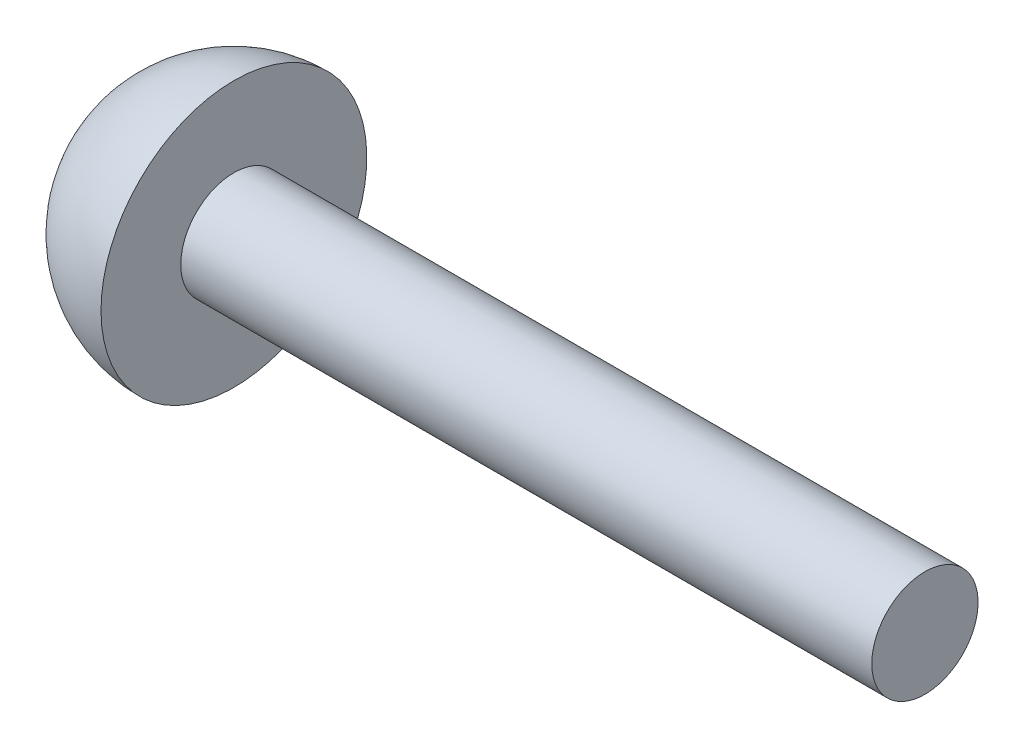
from build123d import *


with BuildPart() as part:
    # Sketch1 → Revolve1 (revolve)
    with BuildSketch(Plane.XY, mode=Mode.PRIVATE) as revolve1_sk:
        with BuildLine():
            Line((0, 0), (0, 2))
            Line((0, 2), (-26, 2))
            Line((-26, 2), (-26, 5))
            ThreePointArc((-26, 5), (-29.535533906, 3.535533906), (-31, 0))
            Line((-31, 0), (0, 0))
        make_face()
    revolve(revolve1_sk.sketch.rotate(Axis((-31, 0, 0), (1, 0, 0)), 90), axis=Axis((-31, 0, 0), (1, 0, 0)))


solid = part.part
